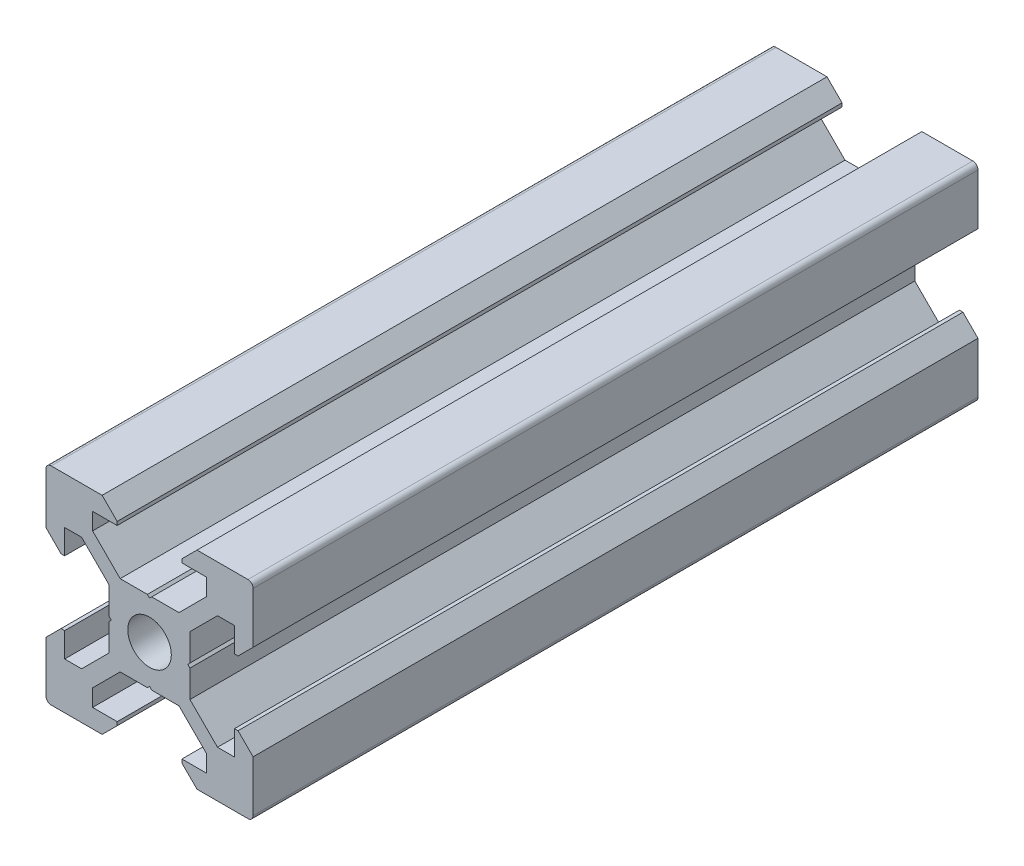
from build123d import *

# Parameters (mm, degrees)
ESBO_O1_R                = 2.1
RESSALTO_EXTRUS_O1_DEPTH = 70


with BuildPart() as part:
    # Esboço1 → Ressalto-extrusão1 (new body)
    with BuildSketch(Plane.XY):
        with BuildLine():
            Line((3.9, -0.21), (3.69, 0))
            Line((3.69, 0), (3.9, 0.21))
            Line((3.9, 0.21), (3.9, 2.839339828))
            Line((3.9, 2.839339828), (6.560660172, 5.5))
            Line((6.560660172, 5.5), (8.2, 5.5))
            Line((8.2, 5.5), (8.2, 3.125))
            Line((8.2, 3.125), (8.545, 3.125))
            Line((8.545, 3.125), (10, 4.58))
            Line((10, 4.58), (10, 9.5))
            ThreePointArc((10, 9.5), (9.853553391, 9.853553391), (9.5, 10))
            Line((9.5, 10), (4.58, 10))
            Line((4.58, 10), (3.125, 8.545))
            Line((3.125, 8.545), (3.125, 8.2))
            Line((3.125, 8.2), (5.5, 8.2))
            Line((5.5, 8.2), (5.5, 6.560660172))
            Line((5.5, 6.560660172), (2.839339828, 3.9))
            Line((2.839339828, 3.9), (0.21, 3.9))
            Line((0.21, 3.9), (0, 3.69))
            Line((0, 3.69), (-0.21, 3.9))
            Line((-0.21, 3.9), (-2.839339828, 3.9))
            Line((-2.839339828, 3.9), (-5.5, 6.560660172))
            Line((-5.5, 6.560660172), (-5.5, 8.2))
            Line((-5.5, 8.2), (-3.125, 8.2))
            Line((-3.125, 8.2), (-3.125, 8.545))
            Line((-3.125, 8.545), (-4.58, 10))
            Line((-4.58, 10), (-9.5, 10))
            ThreePointArc((-9.5, 10), (-9.853553391, 9.853553391), (-10, 9.5))
            Line((-10, 9.5), (-10, 4.58))
            Line((-10, 4.58), (-8.545, 3.125))
            Line((-8.545, 3.125), (-8.2, 3.125))
            Line((-8.2, 3.125), (-8.2, 5.5))
            Line((-8.2, 5.5), (-6.560660172, 5.5))
            Line((-6.560660172, 5.5), (-3.9, 2.839339828))
            Line((-3.9, 2.839339828), (-3.9, 0.21))
            Line((-3.9, 0.21), (-3.69, 0))
            Line((-3.69, 0), (-3.9, -0.21))
            Line((-3.9, -0.21), (-3.9, -2.839339828))
            Line((-3.9, -2.839339828), (-6.560660172, -5.5))
            Line((-6.560660172, -5.5), (-8.2, -5.5))
            Line((-8.2, -5.5), (-8.2, -3.125))
            Line((-8.2, -3.125), (-8.545, -3.125))
            Line((-8.545, -3.125), (-10, -4.58))
            Line((-10, -4.58), (-10, -9.5))
            ThreePointArc((-10, -9.5), (-9.853553391, -9.853553391), (-9.5, -10))
            Line((-9.5, -10), (-4.58, -10))
            Line((-4.58, -10), (-3.125, -8.545))
            Line((-3.125, -8.545), (-3.125, -8.2))
            Line((-3.125, -8.2), (-5.5, -8.2))
            Line((-5.5, -8.2), (-5.5, -6.560660172))
            Line((-5.5, -6.560660172), (-2.839339828, -3.9))
            Line((-2.839339828, -3.9), (-0.21, -3.9))
            Line((-0.21, -3.9), (0, -3.69))
            Line((0, -3.69), (0.21, -3.9))
            Line((0.21, -3.9), (2.839339828, -3.9))
            Line((2.839339828, -3.9), (5.5, -6.560660172))
            Line((5.5, -6.560660172), (5.5, -8.2))
            Line((5.5, -8.2), (3.125, -8.2))
            Line((3.125, -8.2), (3.125, -8.545))
            Line((3.125, -8.545), (4.58, -10))
            Line((4.58, -10), (9.5, -10))
            ThreePointArc((9.5, -10), (9.853553391, -9.853553391), (10, -9.5))
            Line((10, -9.5), (10, -4.58))
            Line((10, -4.58), (8.545, -3.125))
            Line((8.545, -3.125), (8.2, -3.125))
            Line((8.2, -3.125), (8.2, -5.5))
            Line((8.2, -5.5), (6.560660172, -5.5))
            Line((6.560660172, -5.5), (3.9, -2.839339828))
            Line((3.9, -2.839339828), (3.9, -0.21))
        make_face()
        Circle(ESBO_O1_R, mode=Mode.SUBTRACT)
    extrude(amount=RESSALTO_EXTRUS_O1_DEPTH)


solid = part.part
